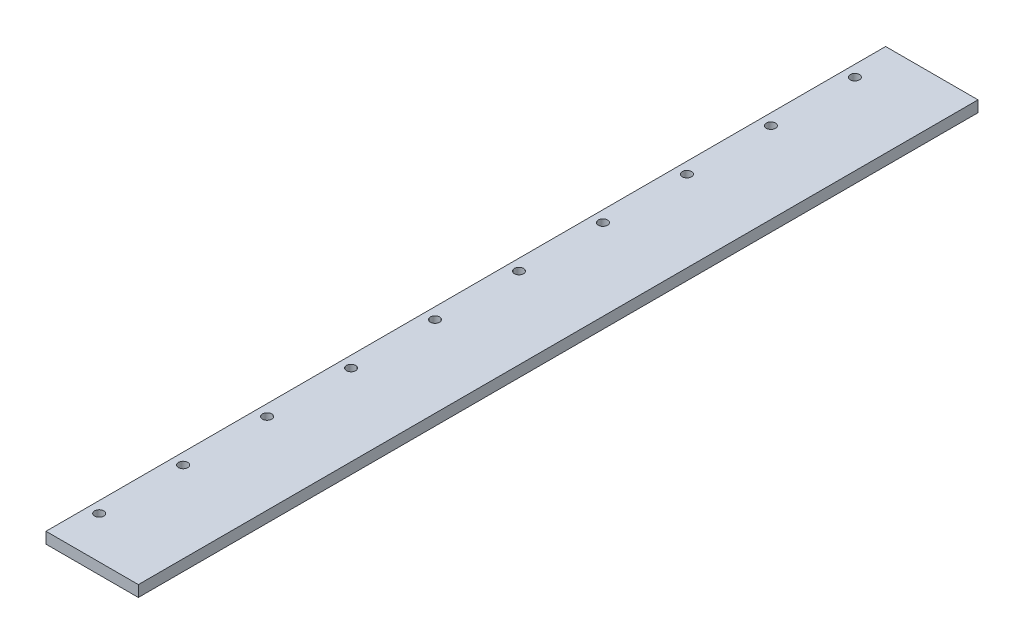
from build123d import *

# Parameters (mm, degrees)
SKETCH1_W           = 33
SKETCH1_H           = 4
BOSS_EXTRUDE1_DEPTH = 300
M4_TAPPED_HOLE1_D   = 3.3
LPATTERN1_COUNT     = 10
LPATTERN1_PITCH     = 30


with BuildPart() as part:
    # Sketch1 → Boss-Extrude1 (new body)
    with BuildSketch(Plane.XY):
        Rectangle(SKETCH1_W, SKETCH1_H)
    extrude(amount=BOSS_EXTRUDE1_DEPTH)

    # M4 Tapped Hole1 (through all)
    with Locations(Plane(origin=(-12.5, 2, 15), x_dir=(0, 0, 1), z_dir=(0, 1, 0))):
        with Locations((0, 0)):
            m4_tapped_hole1 = Hole(M4_TAPPED_HOLE1_D / 2)

    # LPattern1: M4 Tapped Hole1 ×10
    with Locations(*[(0, 0, i * LPATTERN1_PITCH) for i in range(1, LPATTERN1_COUNT)]):
        add(m4_tapped_hole1, mode=Mode.SUBTRACT)


solid = part.part
